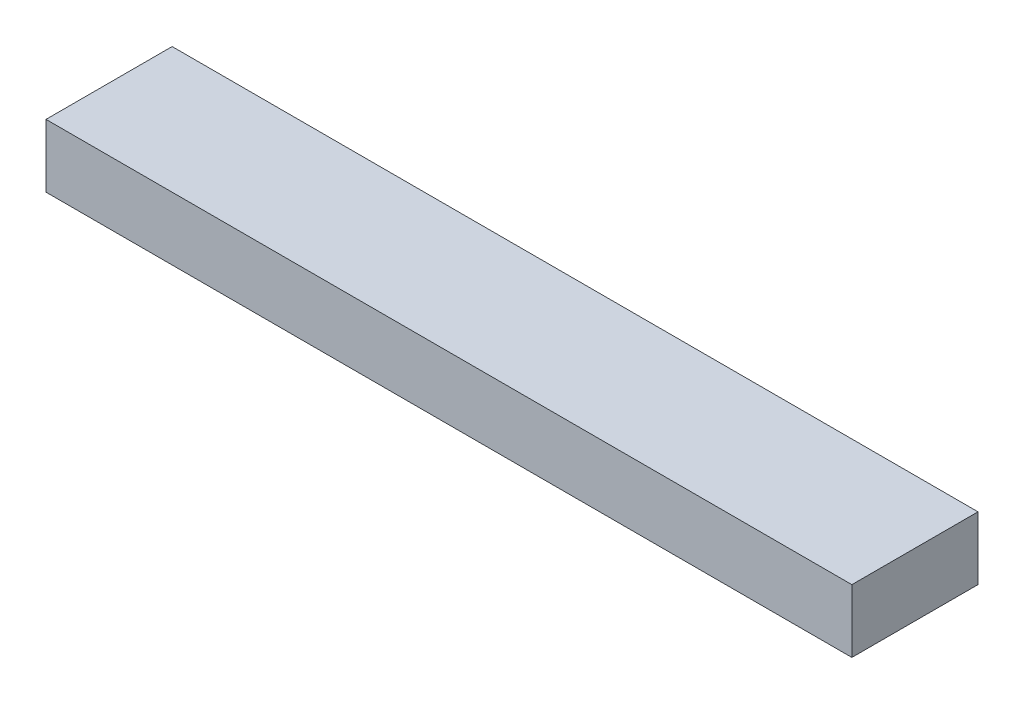
from build123d import *

# Parameters (mm, degrees)
PACK_BOYUNDURUK_PROFIL_36X72_1_START = -364
SKETCH1_W                            = 460
SKETCH1_H                            = 36
PACK_BOYUNDURUK_PROFIL_36X72_1_DEPTH = 72


with BuildPart() as part:
    # Sketch1 → PACK_boyunduruk_profil_36x72_1 (new body)
    with BuildSketch(Plane.XY.offset(PACK_BOYUNDURUK_PROFIL_36X72_1_START)):
        with Locations((350, 488)):
            Rectangle(SKETCH1_W, SKETCH1_H)
    extrude(amount=-PACK_BOYUNDURUK_PROFIL_36X72_1_DEPTH)


solid = part.part
